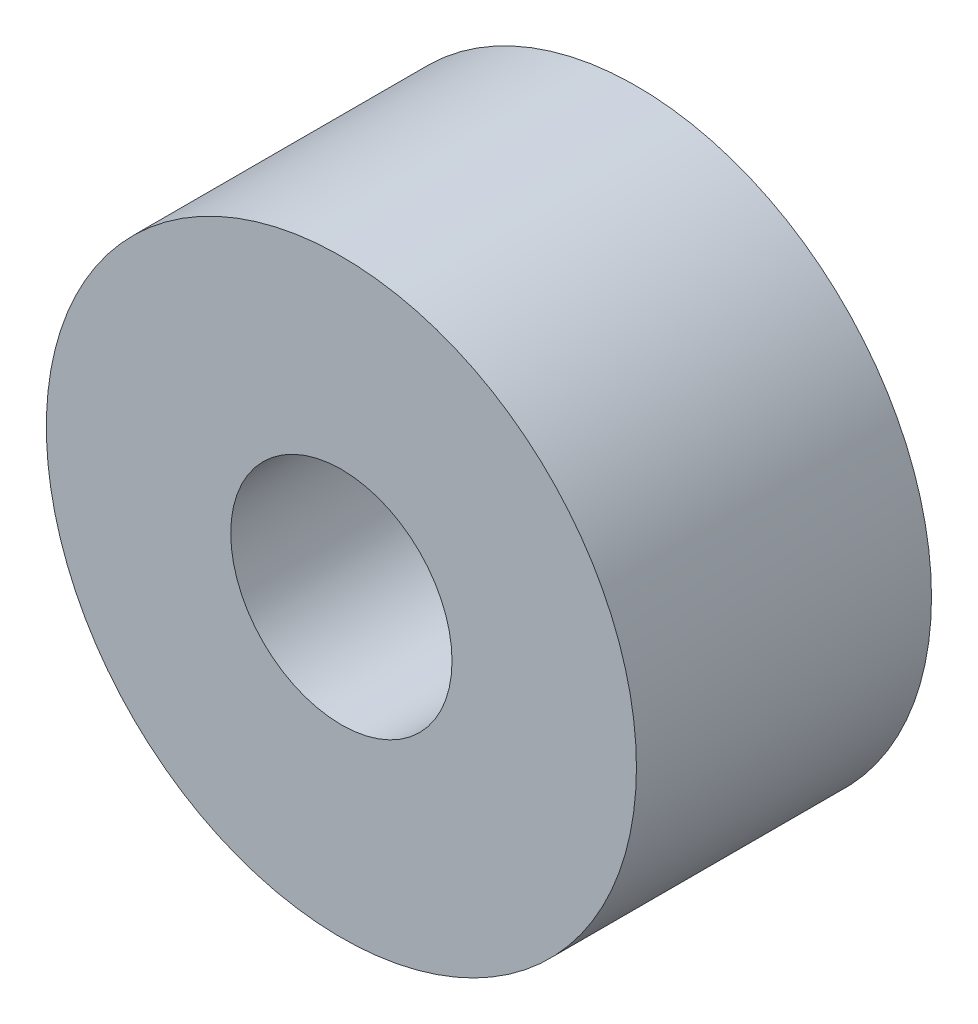
from build123d import *

# Parameters (mm, degrees)
SKETCH2_R           = 6.35
SKETCH2_R_2         = 2.38125
BOSS_EXTRUDE1_DEPTH = 3.175


with BuildPart() as part:
    # Sketch2 → Boss-Extrude1 (new, symmetric)
    with BuildSketch(Plane.XY):
        Circle(SKETCH2_R)
        Circle(SKETCH2_R_2, mode=Mode.SUBTRACT)
    extrude(amount=BOSS_EXTRUDE1_DEPTH, both=True)


solid = part.part
